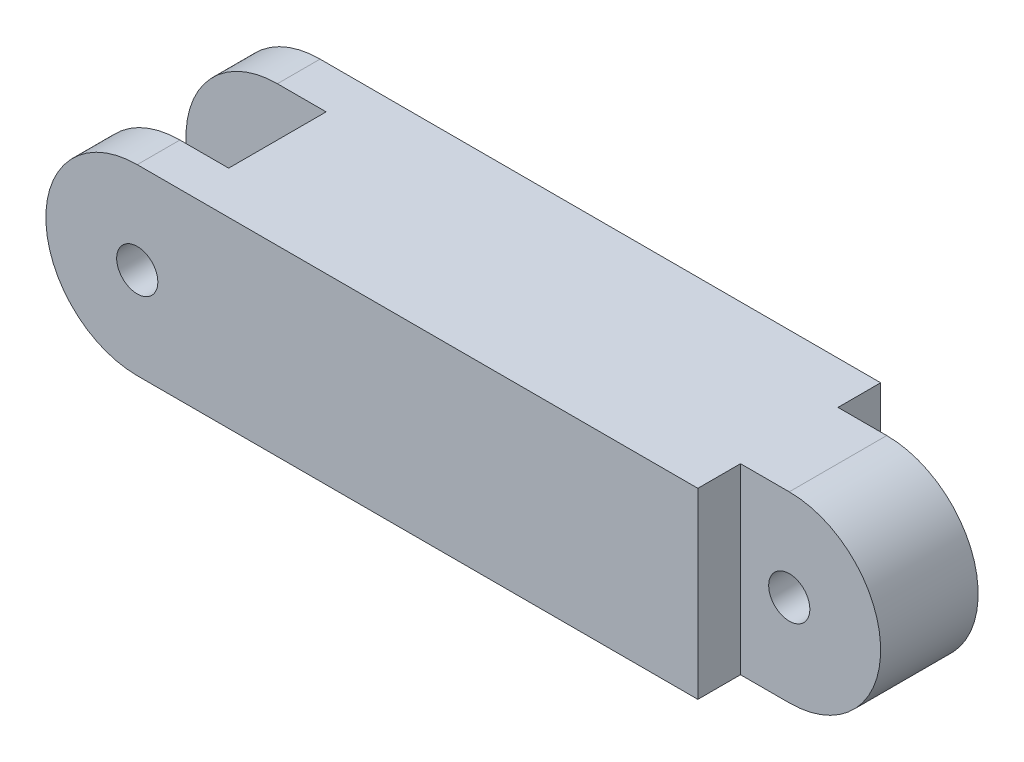
from build123d import *

# Parameters (mm, degrees)
BOSS_EXTRUDE1_DEPTH      = 15
H_0_266_DIAMETER_HOLE1_D = 6.7564
SKETCH5_W                = 40
SKETCH5_H                = 16
SKETCH5_H_2              = 20.916111238
CUT_EXTRUDE1_DEPTH       = 74.143694192


with BuildPart() as part:
    # Sketch1 → Boss-Extrude1 (new, symmetric)
    with BuildSketch(Plane.XY):
        with BuildLine():
            Line((-50, 15), (50, 15))
            ThreePointArc((50, 15), (65, 0), (50, -15))
            Line((50, -15), (-50, -15))
            ThreePointArc((-50, -15), (-65, 0), (-50, 15))
        make_face()
    extrude(amount=BOSS_EXTRUDE1_DEPTH, both=True)

    # H (0.266) Diameter Hole1 (through all)
    with Locations(Plane.XY.offset(15)):
        with Locations((-50, 0), (50, 0)):
            Hole(H_0_266_DIAMETER_HOLE1_D / 2)

    # Sketch5 → Cut-Extrude1 (cut, through all)
    with BuildSketch(Plane(origin=(0, 15, 0), x_dir=(1, 0, 0), z_dir=(0, 1, 0))):
        with Locations((-62, 0)):
            Rectangle(SKETCH5_W, SKETCH5_H)
        with Locations((62, 18.458055619)):
            Rectangle(SKETCH5_W, SKETCH5_H_2)
        with Locations((62, -18.458055619)):
            Rectangle(SKETCH5_W, SKETCH5_H_2)
    extrude(amount=-CUT_EXTRUDE1_DEPTH, mode=Mode.SUBTRACT)


solid = part.part
